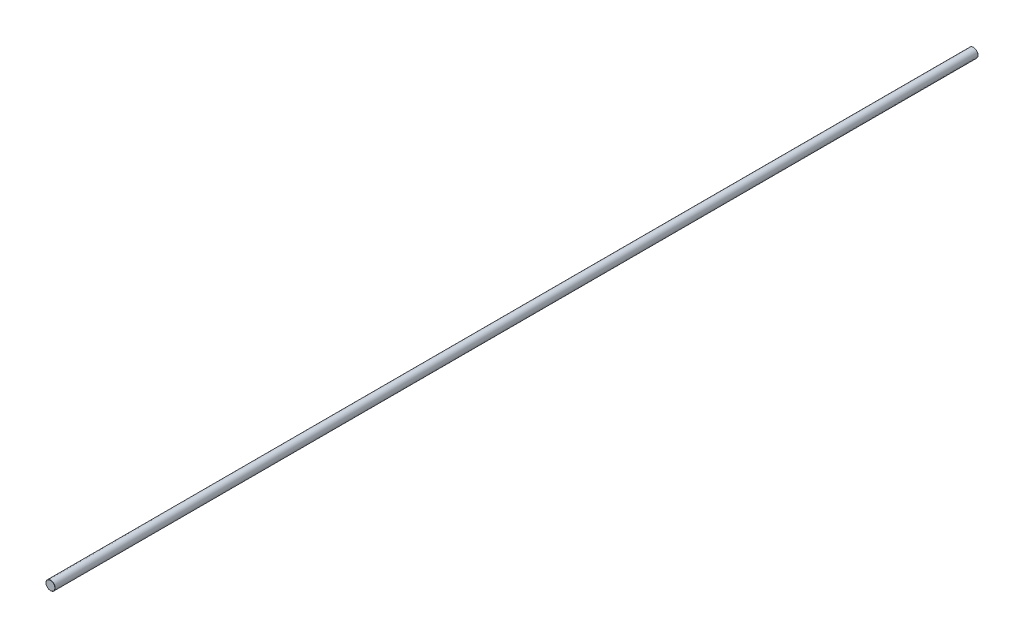
from build123d import *

# Parameters (mm, degrees)
BOSS_EXTRUDE1_DEPTH      = 500
BOSS_EXTRUDE1_DEPTH_BACK = 500
SKETCH3_R                = 5
CHAMFER1_SIZE            = 0.2


with BuildPart() as part:
    # Sketch3 → Boss-Extrude1 (new, two sides: drawn at the far end of the back side and taken through both)
    with BuildSketch(Plane.XY.offset(-BOSS_EXTRUDE1_DEPTH_BACK)):
        Circle(SKETCH3_R)
    extrude(amount=BOSS_EXTRUDE1_DEPTH + BOSS_EXTRUDE1_DEPTH_BACK)

    # Chamfer1
    chamfer1_edges = [part.edges().sort_by_distance(p)[0] for p in [
        (-5, 0, -500),
        (-5, 0, 500),
    ]]
    chamfer(chamfer1_edges, length=CHAMFER1_SIZE)


solid = part.part
